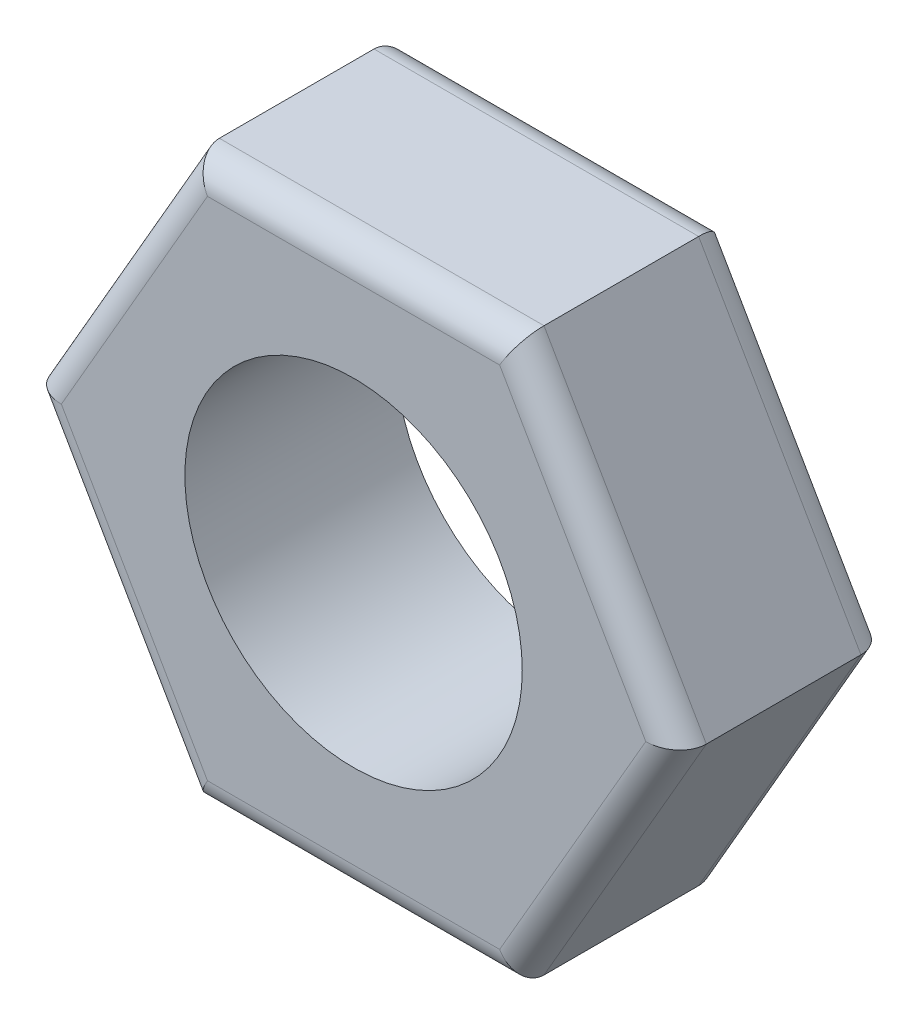
from build123d import *

# Parameters (mm, degrees)
EXTRUDE_3_DEPTH     = 7.5
FILLET_3_R          = 1
SKETCH_4_R          = 6
CUT_EXTRUDE_1_DEPTH = 18.017148214


with BuildPart() as part:
    # 草图1 → 凸台-拉伸3 (new body)
    with BuildSketch(Plane.XY):
        Polygon((5.773502692, -10), (11.547005384, 0), (5.773502692, 10), (-5.773502692, 10), (-11.547005384, 0), (-5.773502692, -10), align=None)
    extrude(amount=EXTRUDE_3_DEPTH)

    # 圆角3
    fillet_3_edges = [part.edges().sort_by_distance(p)[0] for p in [
        (8.660254038, 5, 7.5),
        (0, 10, 7.5),
        (-8.660254038, 5, 7.5),
        (-8.660254038, -5, 7.5),
        (0, -10, 7.5),
        (-8.660254038, -5, 0),
        (-8.660254038, 5, 0),
        (0, 10, 0),
        (8.660254038, -5, 7.5),
        (8.660254038, 5, 0),
        (8.660254038, -5, 0),
        (0, -10, 0),
    ]]
    fillet(fillet_3_edges, radius=FILLET_3_R)

    # 草图4 → 切除-拉伸1 (cut, through all)
    with BuildSketch(Plane.XY.offset(7.5)):
        Circle(SKETCH_4_R)
    extrude(amount=-CUT_EXTRUDE_1_DEPTH, mode=Mode.SUBTRACT)


solid = part.part
